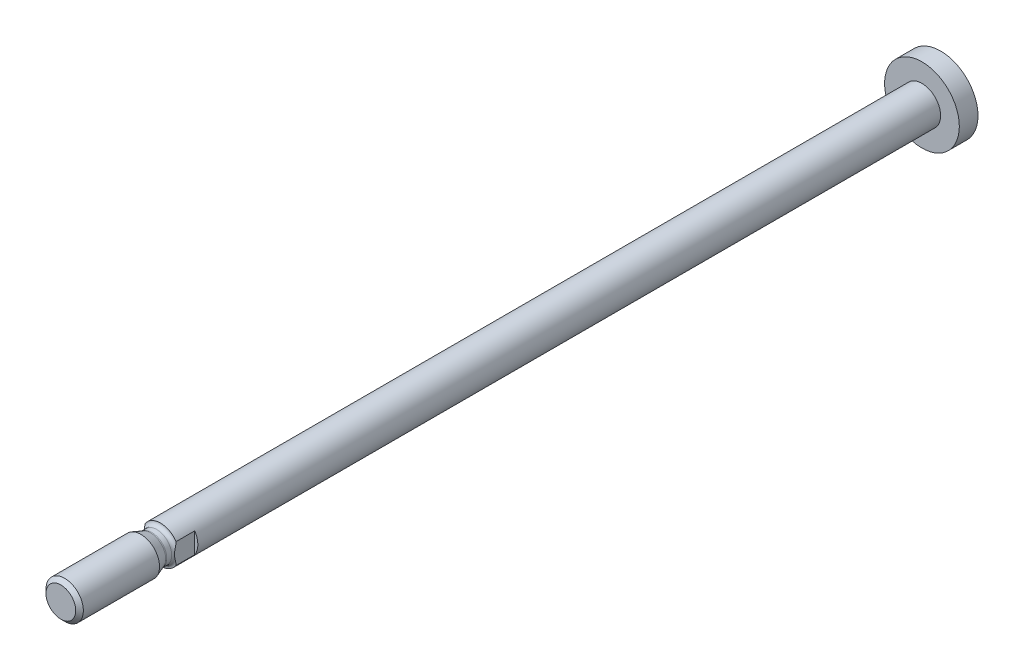
from build123d import *

# Parameters (mm, degrees)
CUT_EXTRUDE1_DEPTH = 4


with BuildPart() as part:
    # Sketch1 → Revolve1 (revolve)
    with BuildSketch(Plane(origin=(0, 0, 0), x_dir=(0, 0, -1), z_dir=(1, 0, 0))):
        Polygon((-5, 0), (-5, 3), (117.3, 3), (117.3, 6), (120.3, 6), (120.3, 0), align=None)
    revolve(axis=Axis((0, 0, -120.3), (0, 0, 1)))

    # Sketch2 → Revolve2 (revolve)
    with BuildSketch(Plane(origin=(0, 0, 0), x_dir=(0, 0, -1), z_dir=(1, 0, 0))):
        with BuildLine():
            Line((-21, 0), (-21, 2.3865))
            Line((-21, 2.3865), (-20.3865, 3))
            Line((-20.3865, 3), (-8.148486452, 3))
            Line((-8.148486452, 3), (-6.599415898, 2.436184428))
            ThreePointArc((-6.599415898, 2.436184428), (-6.498392718, 2.409115348), (-6.394203812, 2.4))
            Line((-6.394203812, 2.4), (-5.6, 2.4))
            ThreePointArc((-5.6, 2.4), (-5.175735931, 2.575735931), (-5, 3))
            Line((-5, 3), (-4, 3))
            Line((-4, 3), (-4, 0))
            Line((-4, 0), (-21, 0))
        make_face()
    revolve(axis=Axis((0, 0, 4), (0, 0, 1)))

    # Sketch3 → Cut-Extrude1 (cut)
    with BuildSketch(Plane.XY.offset(2)):
        Polygon((-5, 10), (-5, -5), (-2.5, -5), (-2.5, 5), (2.5, 5), (2.5, -5), (5, -5), (5, 10), align=None)
    extrude(amount=CUT_EXTRUDE1_DEPTH, mode=Mode.SUBTRACT)


solid = part.part
